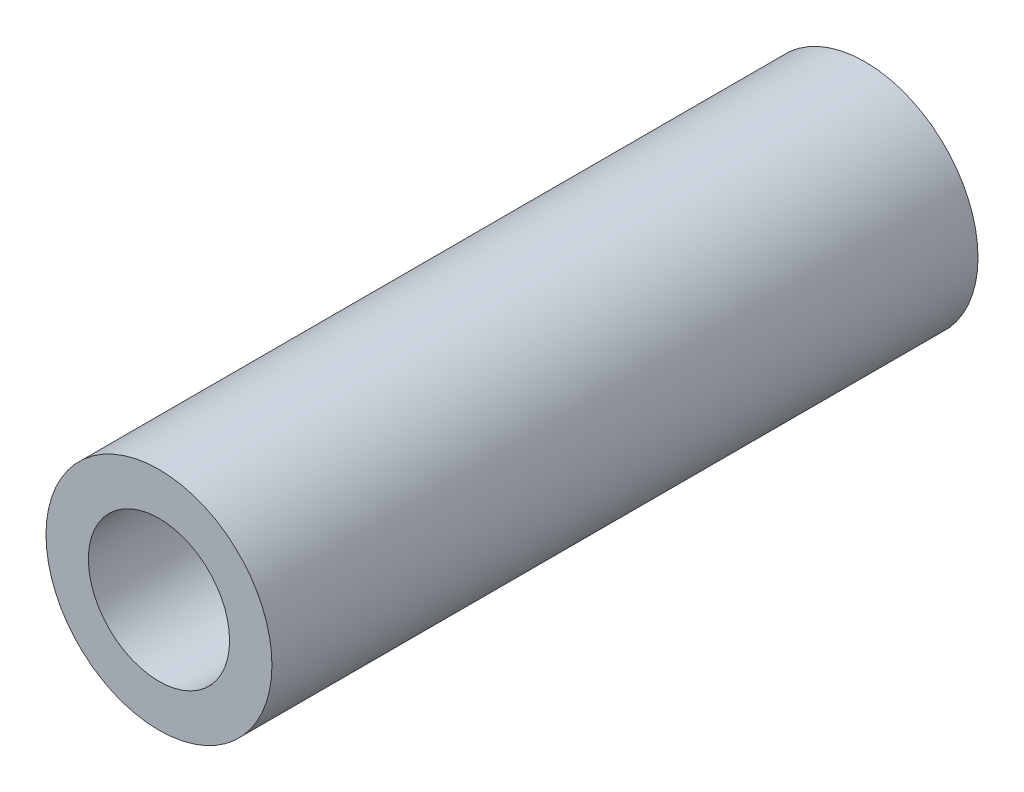
from build123d import *

# Parameters (mm, degrees)
SKETCH_1_R      = 4
SKETCH_1_R_2    = 2.5
EXTRUDE_1_DEPTH = 12.5


with BuildPart() as part:
    # 草图1 → 凸台-拉伸1 (new, symmetric)
    with BuildSketch(Plane.XY):
        Circle(SKETCH_1_R)
        Circle(SKETCH_1_R_2, mode=Mode.SUBTRACT)
    extrude(amount=EXTRUDE_1_DEPTH, both=True)


solid = part.part
